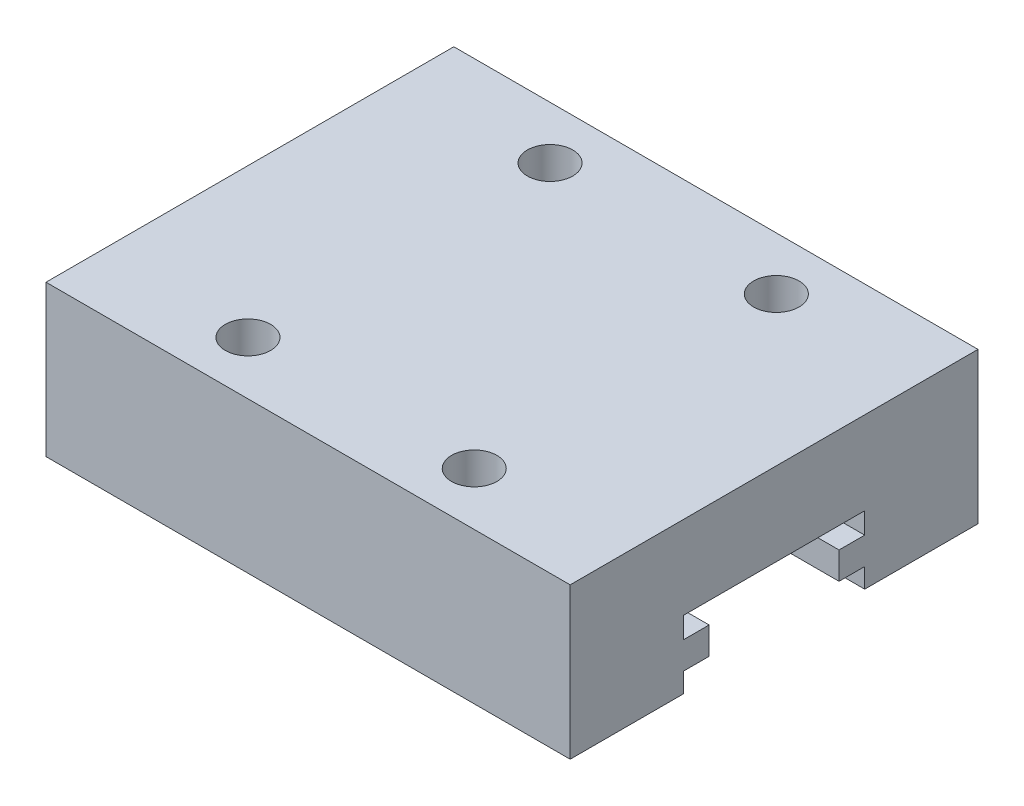
from build123d import *

# Parameters (mm, degrees)
CROQUIS1_W              = 34.7
CROQUIS1_H              = 27
SALIENTE_EXTRUIR1_DEPTH = 10
CROQUIS2_R              = 1.5
CORTAR_EXTRUIR1_DEPTH   = 5
CORTAR_EXTRUIR2_DEPTH   = 34.7


with BuildPart() as part:
    # Croquis1 → Saliente-Extruir1 (new body)
    with BuildSketch(Plane(origin=(0, 0, 0), x_dir=(1, 0, 0), z_dir=(0, 1, 0))):
        with Locations((17.35, 13.5)):
            Rectangle(CROQUIS1_W, CROQUIS1_H)
    extrude(amount=SALIENTE_EXTRUIR1_DEPTH)

    # Croquis2 → Cortar-Extruir1 (cut)
    with BuildSketch(Plane(origin=(0, 10, 0), x_dir=(1, 0, 0), z_dir=(0, 1, 0))):
        with Locations(Location((9.85, 23.52014925, 0), (0, 0, 270))):
            Circle(CROQUIS2_R)
        with Locations(Location((24.849986467, 23.5, 0), (0, 0, 270))):
            Circle(CROQUIS2_R)
        with Locations(Location((9.85, 3.52014925, 0), (0, 0, 270))):
            Circle(CROQUIS2_R)
        with Locations(Location((24.849986467, 3.5, 0), (0, 0, 270))):
            Circle(CROQUIS2_R)
    extrude(amount=-CORTAR_EXTRUIR1_DEPTH, mode=Mode.SUBTRACT)

    # Croquis3 → Cortar-Extruir2 (cut)
    with BuildSketch(Plane(origin=(34.7, 0, 0), x_dir=(0, 0, -1), z_dir=(1, 0, 0))):
        Polygon((7.5, 0), (19.5, 0), (19.5, 1.3), (17.8, 1.3), (17.8, 3.1), (19.5, 3.1), (19.5, 4.5), (7.5, 4.5), (7.5, 3.1), (9.2, 3.1), (9.2, 1.3), (7.5, 1.3), align=None)
    extrude(amount=-CORTAR_EXTRUIR2_DEPTH, mode=Mode.SUBTRACT)


solid = part.part
